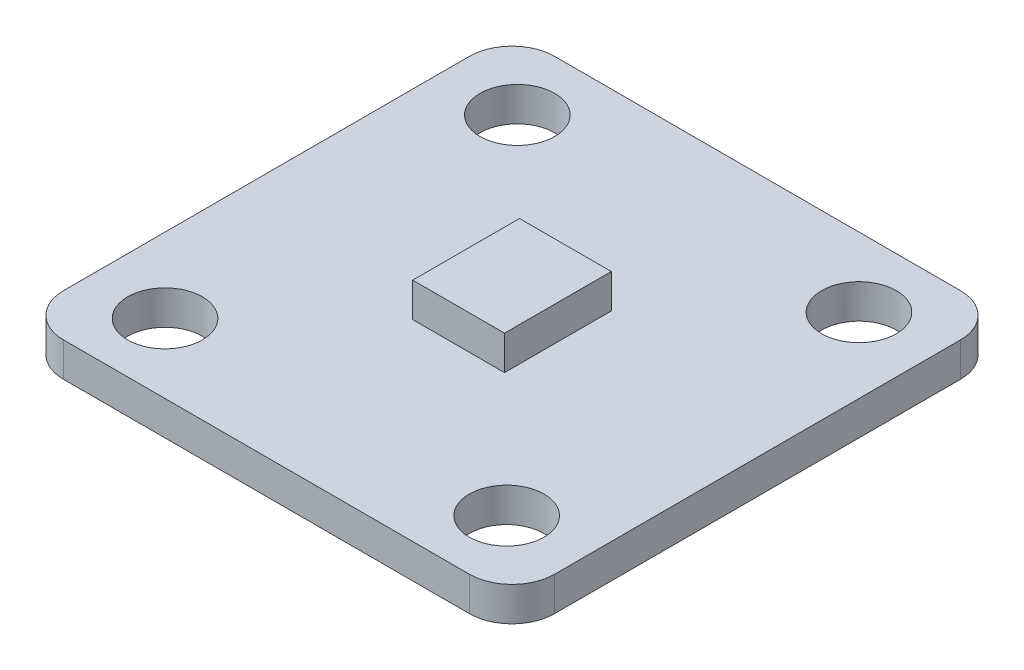
from build123d import *

# Parameters (mm, degrees)
SKETCH1_W           = 23
SKETCH1_H           = 23
BOSS_EXTRUDE1_DEPTH = 1.6
FILLET1_R           = 2
CUT_EXTRUDE1_REACH  = 18.342
SKETCH2_R           = 1.75
SKETCH3_W           = 4.3
SKETCH3_H           = 5
BOSS_EXTRUDE2_DEPTH = 1.6


with BuildPart() as part:
    # Sketch1 → Boss-Extrude1 (new body)
    with BuildSketch(Plane(origin=(0, 0, 0), x_dir=(1, 0, 0), z_dir=(0, 1, 0))):
        Rectangle(SKETCH1_W, SKETCH1_H)
    extrude(amount=BOSS_EXTRUDE1_DEPTH)

    # Fillet1
    fillet1_edges = [part.edges().sort_by_distance(p)[0] for p in [
        (11.5, 0.8, 11.5),
        (-11.5, 0.8, 11.5),
        (-11.5, 0.8, -11.5),
        (11.5, 0.8, -11.5),
    ]]
    fillet(fillet1_edges, radius=FILLET1_R)

    # Sketch2 → Cut-Extrude1 (cut, up to next)
    with BuildSketch(Plane(origin=(0, 1.6, 0), x_dir=(1, 0, 0), z_dir=(0, 1, 0)), mode=Mode.PRIVATE) as cut_extrude1_sk1:
        with Locations(Location((-8, 8.25, 0), (0, 0, 270))):
            Circle(SKETCH2_R)
    cut_extrude1_tool1 = extrude(cut_extrude1_sk1.sketch, amount=-CUT_EXTRUDE1_REACH, mode=Mode.PRIVATE) & part.part
    # Sketch2 → Cut-Extrude1 (cut, up to next)
    with BuildSketch(Plane(origin=(0, 1.6, 0), x_dir=(1, 0, 0), z_dir=(0, 1, 0)), mode=Mode.PRIVATE) as cut_extrude1_sk2:
        with Locations(Location((8, 8.25, 0), (0, 0, 270))):
            Circle(SKETCH2_R)
    cut_extrude1_tool2 = extrude(cut_extrude1_sk2.sketch, amount=-CUT_EXTRUDE1_REACH, mode=Mode.PRIVATE) & part.part
    # Sketch2 → Cut-Extrude1 (cut, up to next)
    with BuildSketch(Plane(origin=(0, 1.6, 0), x_dir=(1, 0, 0), z_dir=(0, 1, 0)), mode=Mode.PRIVATE) as cut_extrude1_sk3:
        with Locations(Location((8, -8.25, 0), (0, 0, 270))):
            Circle(SKETCH2_R)
    cut_extrude1_tool3 = extrude(cut_extrude1_sk3.sketch, amount=-CUT_EXTRUDE1_REACH, mode=Mode.PRIVATE) & part.part
    # Sketch2 → Cut-Extrude1 (cut, up to next)
    with BuildSketch(Plane(origin=(0, 1.6, 0), x_dir=(1, 0, 0), z_dir=(0, 1, 0)), mode=Mode.PRIVATE) as cut_extrude1_sk4:
        with Locations(Location((-8, -8.25, 0), (0, 0, 270))):
            Circle(SKETCH2_R)
    cut_extrude1_tool4 = extrude(cut_extrude1_sk4.sketch, amount=-CUT_EXTRUDE1_REACH, mode=Mode.PRIVATE) & part.part
    add(cut_extrude1_tool1.solids().sort_by_distance((-8, 1.6, -8.25))[0], mode=Mode.SUBTRACT)
    add(cut_extrude1_tool2.solids().sort_by_distance((8, 1.6, -8.25))[0], mode=Mode.SUBTRACT)
    add(cut_extrude1_tool3.solids().sort_by_distance((8, 1.6, 8.25))[0], mode=Mode.SUBTRACT)
    add(cut_extrude1_tool4.solids().sort_by_distance((-8, 1.6, 8.25))[0], mode=Mode.SUBTRACT)

    # Sketch3 → Boss-Extrude2 (add)
    with BuildSketch(Plane(origin=(0, 1.6, 0), x_dir=(1, 0, 0), z_dir=(0, 1, 0))):
        Rectangle(SKETCH3_W, SKETCH3_H)
    extrude(amount=BOSS_EXTRUDE2_DEPTH)


solid = part.part
